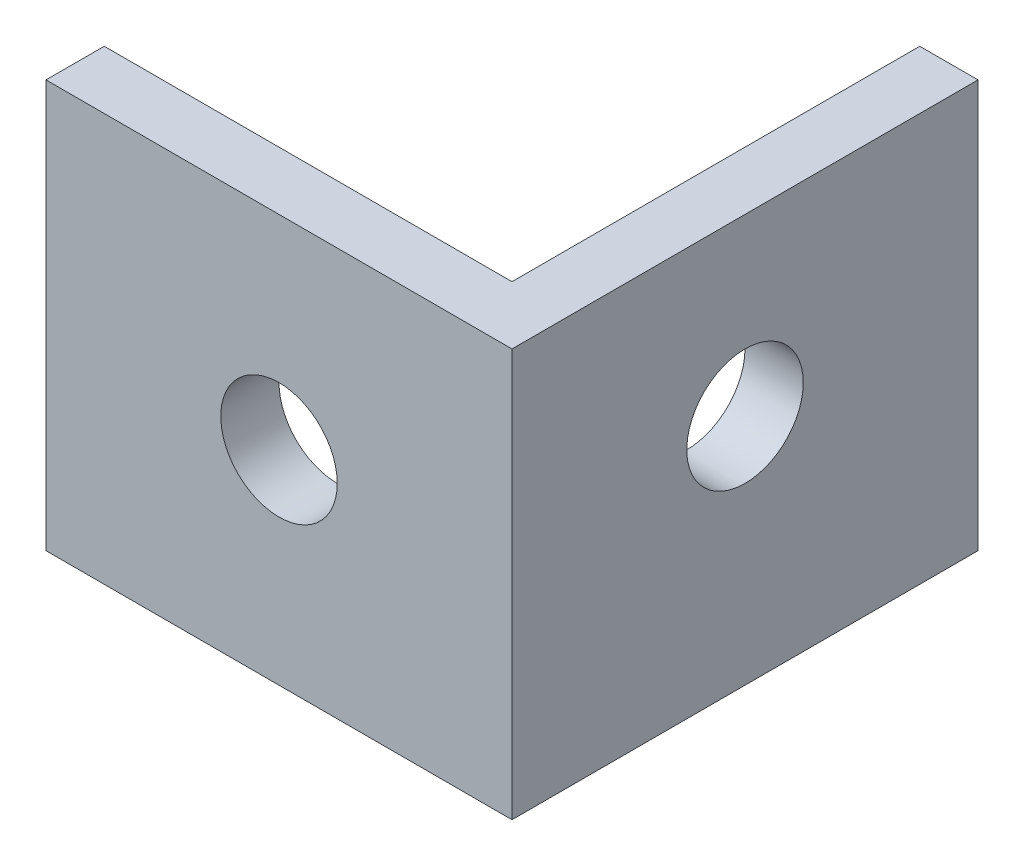
from build123d import *

# Parameters (mm, degrees)
BOSS_EXTRUDE1_DEPTH = 22.225
SKETCH2_R           = 3.175
CUT_EXTRUDE1_DEPTH  = 25.4
SKETCH3_R           = 3.175
CUT_EXTRUDE2_DEPTH  = 25.4


with BuildPart() as part:
    # Sketch1 → Boss-Extrude1 (new body)
    with BuildSketch(Plane(origin=(0, 0, 0), x_dir=(1, 0, 0), z_dir=(0, 1, 0))):
        Polygon((0, 0), (25.4, 0), (25.4, 25.4), (22.225, 25.4), (22.225, 3.175), (0, 3.175), align=None)
    extrude(amount=BOSS_EXTRUDE1_DEPTH)

    # Sketch2 → Cut-Extrude1 (cut)
    with BuildSketch(Plane(origin=(25.4, 0, 0), x_dir=(0, 0, -1), z_dir=(1, 0, 0))):
        with Locations((12.7, 12.7)):
            Circle(SKETCH2_R)
    extrude(amount=-CUT_EXTRUDE1_DEPTH, mode=Mode.SUBTRACT)

    # Sketch3 → Cut-Extrude2 (cut)
    with BuildSketch(Plane.XY):
        with Locations((12.7, 11.1125)):
            Circle(SKETCH3_R)
    extrude(amount=-CUT_EXTRUDE2_DEPTH, mode=Mode.SUBTRACT)


solid = part.part
